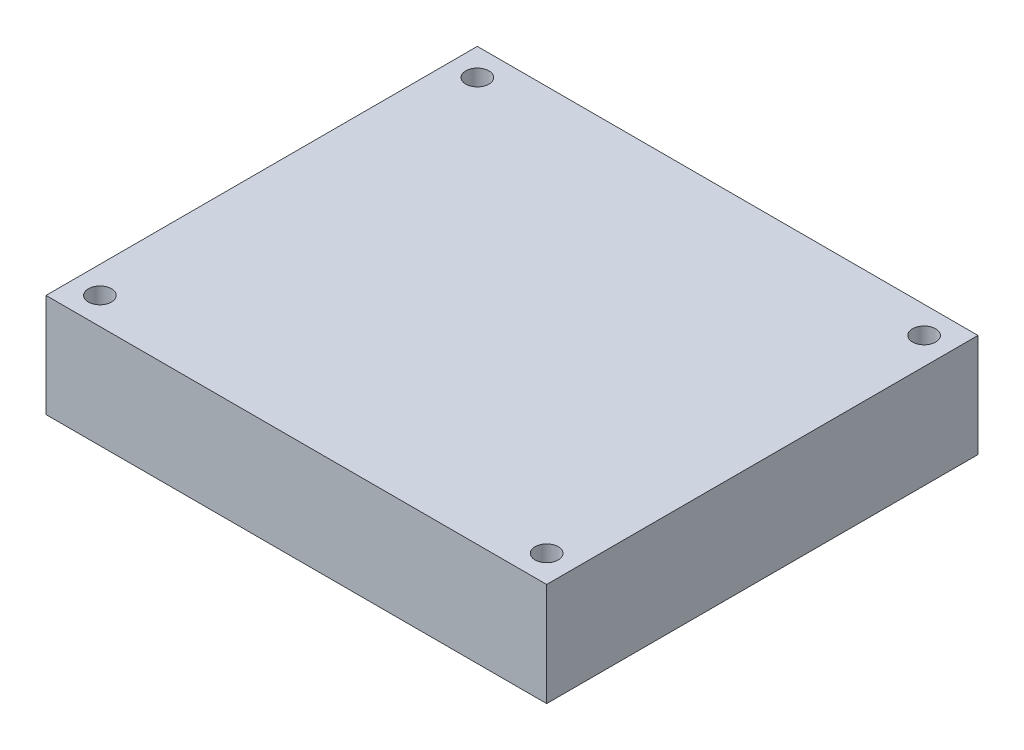
from build123d import *

# Parameters (mm, degrees)
SKETCH1_W           = 65
SKETCH1_H           = 56
BOSS_EXTRUDE1_DEPTH = 13.4
CUT_EXTRUDE1_REACH  = 46.942
SKETCH2_R           = 1.5


with BuildPart() as part:
    # Sketch1 → Boss-Extrude1 (new body)
    with BuildSketch(Plane(origin=(0, 0, 0), x_dir=(1, 0, 0), z_dir=(0, 1, 0))):
        Rectangle(SKETCH1_W, SKETCH1_H)
    extrude(amount=-BOSS_EXTRUDE1_DEPTH)

    # Sketch2 → Cut-Extrude1 (cut, up to next)
    with BuildSketch(Plane(origin=(0, 0, 0), x_dir=(1, 0, 0), z_dir=(0, 1, 0)), mode=Mode.PRIVATE) as cut_extrude1_sk1:
        with Locations(Location((29, 24.5, 0), (0, 0, 270))):
            Circle(SKETCH2_R)
    cut_extrude1_tool1 = extrude(cut_extrude1_sk1.sketch, amount=-CUT_EXTRUDE1_REACH, mode=Mode.PRIVATE) & part.part
    # Sketch2 → Cut-Extrude1 (cut, up to next)
    with BuildSketch(Plane(origin=(0, 0, 0), x_dir=(1, 0, 0), z_dir=(0, 1, 0)), mode=Mode.PRIVATE) as cut_extrude1_sk2:
        with Locations(Location((29, -24.5, 0), (0, 0, 270))):
            Circle(SKETCH2_R)
    cut_extrude1_tool2 = extrude(cut_extrude1_sk2.sketch, amount=-CUT_EXTRUDE1_REACH, mode=Mode.PRIVATE) & part.part
    # Sketch2 → Cut-Extrude1 (cut, up to next)
    with BuildSketch(Plane(origin=(0, 0, 0), x_dir=(1, 0, 0), z_dir=(0, 1, 0)), mode=Mode.PRIVATE) as cut_extrude1_sk3:
        with Locations(Location((-29, -24.5, 0), (0, 0, 270))):
            Circle(SKETCH2_R)
    cut_extrude1_tool3 = extrude(cut_extrude1_sk3.sketch, amount=-CUT_EXTRUDE1_REACH, mode=Mode.PRIVATE) & part.part
    # Sketch2 → Cut-Extrude1 (cut, up to next)
    with BuildSketch(Plane(origin=(0, 0, 0), x_dir=(1, 0, 0), z_dir=(0, 1, 0)), mode=Mode.PRIVATE) as cut_extrude1_sk4:
        with Locations(Location((-29, 24.5, 0), (0, 0, 270))):
            Circle(SKETCH2_R)
    cut_extrude1_tool4 = extrude(cut_extrude1_sk4.sketch, amount=-CUT_EXTRUDE1_REACH, mode=Mode.PRIVATE) & part.part
    add(cut_extrude1_tool1.solids().sort_by_distance((29, 0, -24.5))[0], mode=Mode.SUBTRACT)
    add(cut_extrude1_tool2.solids().sort_by_distance((29, 0, 24.5))[0], mode=Mode.SUBTRACT)
    add(cut_extrude1_tool3.solids().sort_by_distance((-29, 0, 24.5))[0], mode=Mode.SUBTRACT)
    add(cut_extrude1_tool4.solids().sort_by_distance((-29, 0, -24.5))[0], mode=Mode.SUBTRACT)


solid = part.part
